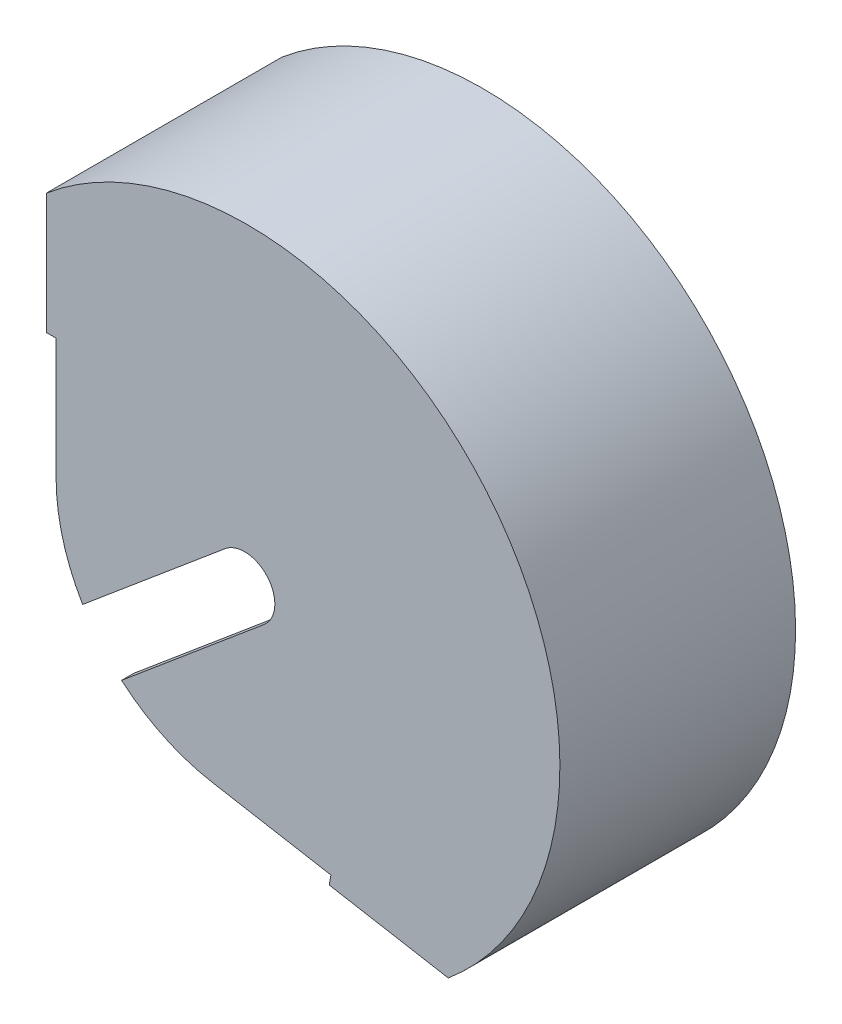
from build123d import *

# Parameters (mm, degrees)
SIDE_DEPTH             = 2.54
COVER_DEPTH            = 44.45
FLYWHEEL_SLIT_REACH    = 107.934
MOUNT_HOLES_REACH      = 107.934
SKETCH4_R              = 3.2639
AXLE_HOLDER_HOLE_REACH = 107.934
SKETCH5_R              = 5.08


with BuildPart() as part:
    # Sketch1 → Side (new body)
    with BuildSketch(Plane.XY):
        with BuildLine():
            Line((17.780628438, -45.433815472), (42.794745364, -49.844479185))
            ThreePointArc((42.794745364, -49.844479185), (50.891612275, 42.70313309), (-41.656, 50.8))
            Line((-41.656, 50.8), (-41.656, 25.4))
            Line((-41.656, 25.4), (-39.624, 25.4))
            Line((-39.624, 25.4), (-39.624, 0))
            Line((-39.624, 0), (0, 0))
            Line((0, 0), (-6.880635392, -39.022022405))
            Line((-6.880635392, -39.022022405), (18.133481535, -43.432686118))
            Line((18.133481535, -43.432686118), (17.780628438, -45.433815472))
        make_face()
        with BuildLine():
            Line((0, 0), (-39.624, 0))
            ThreePointArc((-39.624, 0), (-30.353745014, -25.469816246), (-6.880635392, -39.022022405))
            Line((-6.880635392, -39.022022405), (0, 0))
        make_face()
    side = extrude(amount=SIDE_DEPTH)

    # Sketch2 → Cover (add)
    with BuildSketch(Plane.XY.offset(2.54)):
        with BuildLine():
            Line((-40.023319471, 48.854247114), (-41.656, 48.854247114))
            Line((-41.656, 48.854247114), (-41.656, 50.8))
            ThreePointArc((-41.656, 50.8), (50.891612275, 42.70313309), (42.794745364, -49.844479185))
            Line((42.794745364, -49.844479185), (40.878552837, -49.506602742))
            Line((40.878552837, -49.506602742), (41.162064836, -47.898726299))
            ThreePointArc((41.162064836, -47.898726299), (48.945859389, 41.070452561), (-40.023319471, 48.854247114))
        make_face()
    extrude(amount=COVER_DEPTH)

    # Mirror1: Side across plane
    add(side.mirror(Plane.XY.offset(24.765)))

    # Sketch3 → Flywheel slit (cut, up to next)
    with BuildSketch(Plane.XY.offset(49.53), mode=Mode.PRIVATE) as flywheel_slit_sk1:
        with BuildLine():
            Line((-4.081701322, 4.864382214), (-37.159500375, -22.891186772))
            Line((-37.159500375, -22.891186772), (-28.996097732, -32.6199512))
            Line((-28.996097732, -32.6199512), (4.081701322, -4.864382214))
            ThreePointArc((4.081701322, -4.864382214), (4.864382214, 4.081701322), (-4.081701322, 4.864382214))
        make_face()
    flywheel_slit_tool1 = extrude(flywheel_slit_sk1.sketch, amount=-FLYWHEEL_SLIT_REACH, mode=Mode.PRIVATE) & part.part
    add(flywheel_slit_tool1.solids().sort_by_distance((-14.612688, -12.261501, 49.53))[0], mode=Mode.SUBTRACT)

    # Sketch4 → Mount holes (cut, up to next)
    with BuildSketch(Plane(origin=(0, 0, 0), x_dir=(-1, 0, 0), z_dir=(0, 0, -1)), mode=Mode.PRIVATE) as mount_holes_sk1:
        with Locations((-2.116217682, -33.531680079)):
            Circle(SKETCH4_R)
    mount_holes_tool1 = extrude(mount_holes_sk1.sketch, amount=-MOUNT_HOLES_REACH, mode=Mode.PRIVATE) & part.part
    # Sketch4 → Mount holes (cut, up to next)
    with BuildSketch(Plane(origin=(0, 0, 0), x_dir=(-1, 0, 0), z_dir=(0, 0, -1)), mode=Mode.PRIVATE) as mount_holes_sk2:
        with Locations((33.277492898, 10.173950581)):
            Circle(SKETCH4_R)
    mount_holes_tool2 = extrude(mount_holes_sk2.sketch, amount=-MOUNT_HOLES_REACH, mode=Mode.PRIVATE) & part.part
    add(mount_holes_tool1.solids().sort_by_distance((2.116218, -33.53168, 0))[0], mode=Mode.SUBTRACT)
    add(mount_holes_tool2.solids().sort_by_distance((-33.277493, 10.173951, 0))[0], mode=Mode.SUBTRACT)

    # Sketch5 → Axle Holder Hole (cut, up to next)
    with BuildSketch(Plane(origin=(0, 0, 0), x_dir=(-1, 0, 0), z_dir=(0, 0, -1)), mode=Mode.PRIVATE) as axle_holder_hole_sk1:
        Circle(SKETCH5_R)
    axle_holder_hole_tool1 = extrude(axle_holder_hole_sk1.sketch, amount=-AXLE_HOLDER_HOLE_REACH, mode=Mode.PRIVATE) & part.part
    add(axle_holder_hole_tool1.solids().sort_by_distance((0, 0, 0))[0], mode=Mode.SUBTRACT)


solid = part.part
